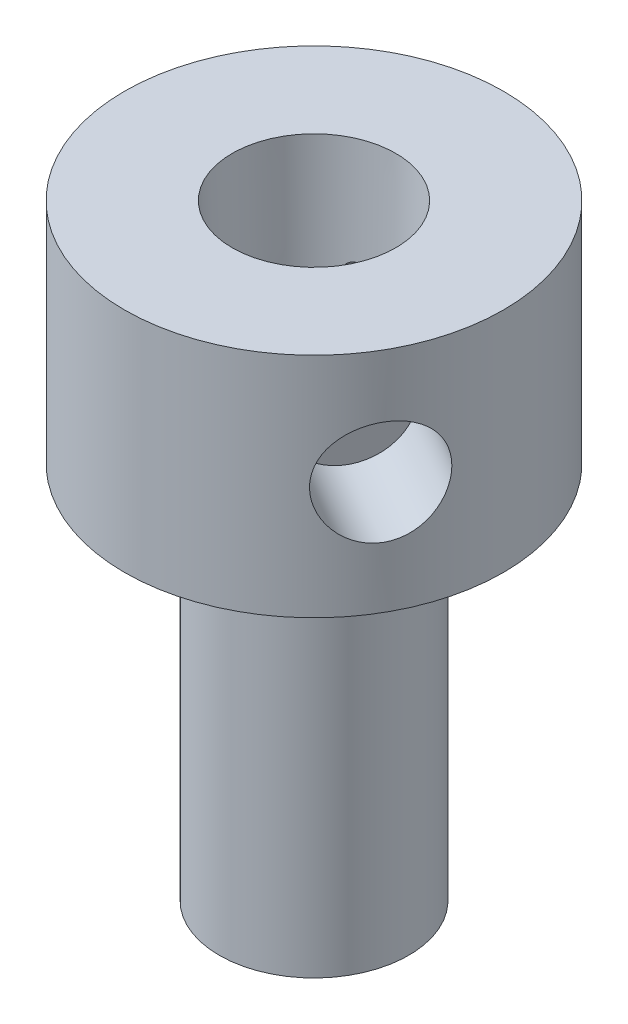
from build123d import *

# Parameters (mm, degrees)
SKETCH1_R                    = 15.875
BOSS_EXTRUDE1_DEPTH          = 50.8
SKETCH2_OUTSIDE_W            = 47.31
SKETCH2_OUTSIDE_H            = 47.31
SKETCH2_OUTSIDE_R            = 7.9375
CUT_EXTRUDE1_DEPTH           = 31.75
F_1_8_0_125_DIAMETER_HOLE1_D = 3.175
CUT_EXTRUDE5_START           = -31.75
SKETCH13_OUTSIDE_W           = 47.31
SKETCH13_OUTSIDE_H           = 47.31
SKETCH13_OUTSIDE_R           = 6.35
CUT_EXTRUDE5_DEPTH           = 1.5875
CUT_EXTRUDE6_REACH           = 65.16
CUT_EXTRUDE6_END_RADIUS      = 15.875
CUT_EXTRUDE6_START           = -7.62
SKETCH15_R                   = 4.365625
CUT_EXTRUDE7_REACH           = 60.178
SKETCH16_R                   = 0.79375
CIRPATTERN1_COUNT            = 2
CIRPATTERN1_ANGLE            = 120
CIRPATTERN2_COUNT            = 2
CIRPATTERN2_ANGLE            = 270


with BuildPart() as part:
    # Sketch1 → Boss-Extrude1 (new body)
    with BuildSketch(Plane(origin=(0, 0, 0), x_dir=(1, 0, 0), z_dir=(0, 1, 0))):
        with Locations(Location((0, 0, 0), (0, 0, 270))):
            Circle(SKETCH1_R)
    extrude(amount=BOSS_EXTRUDE1_DEPTH)

    # Sketch2 outside → Cut-Extrude1 (cut)
    with BuildSketch(Plane(origin=(0, 0, 0), x_dir=(-1, 0, 0), z_dir=(0, -1, 0))):
        Rectangle(SKETCH2_OUTSIDE_W, SKETCH2_OUTSIDE_H)
        with Locations(Location((0, 0, 0), (0, 0, 90))):
            Circle(SKETCH2_OUTSIDE_R, mode=Mode.SUBTRACT)
    extrude(amount=-CUT_EXTRUDE1_DEPTH, mode=Mode.SUBTRACT)

    # 1/8 (0.125) Diameter Hole1 (through all)
    with Locations(Plane(origin=(0, 50.8, 0), x_dir=(1, 0, 0), z_dir=(0, 1, 0))):
        with Locations((0, 0)):
            Hole(F_1_8_0_125_DIAMETER_HOLE1_D / 2)

    # Sketch6 → 1/4 NPT Tapped Hole1 (revolve, cut)
    with BuildSketch(Plane(origin=(0, 50.8, 0), x_dir=(0, 0, 1), z_dir=(1, 0, 0))):
        Polygon((0, 0), (0, 20.275689079), (5.5626, 16.9333418), (5.5626, 9.906), (6.557984794, 9.906), (6.8545837, 0), align=None)
    revolve(axis=Axis((0, 57.15, 0), (0, -1, 0)), mode=Mode.SUBTRACT)

    # Sketch13 outside → Cut-Extrude5 (cut)
    with BuildSketch(Plane.XZ.offset(CUT_EXTRUDE5_START)):
        Rectangle(SKETCH13_OUTSIDE_W, SKETCH13_OUTSIDE_H)
        with Locations(Location((0, 0, 0), (0, 0, 270))):
            Circle(SKETCH13_OUTSIDE_R, mode=Mode.SUBTRACT)
    extrude(amount=CUT_EXTRUDE5_DEPTH, mode=Mode.SUBTRACT)

    # Cut-Extrude6: up to this cylinder (the profile starts inside it)
    cut_extrude6_end = Plane(origin=(0, 41.207118, 0), z_dir=(0, -1, 0)) * Cylinder(CUT_EXTRUDE6_END_RADIUS, 163.07, mode=Mode.PRIVATE)
    # Sketch15 → Cut-Extrude6 (cut, up to the surface)
    with BuildSketch(Plane.XY.offset(CUT_EXTRUDE6_START), mode=Mode.PRIVATE) as cut_extrude6_sk1:
        with Locations((0, 41.207117901)):
            Circle(SKETCH15_R)
    cut_extrude6_tool1 = extrude(cut_extrude6_sk1.sketch, amount=-CUT_EXTRUDE6_REACH, mode=Mode.PRIVATE) & cut_extrude6_end
    cut_extrude6 = cut_extrude6_tool1.solids().sort_by_distance((0, 41.207118, -7.62))[0]
    add(cut_extrude6, mode=Mode.SUBTRACT)

    # Sketch16 → Cut-Extrude7 (cut, up to next)
    with BuildSketch(Plane(origin=(0, 0, -7.62), x_dir=(-1, 0, 0), z_dir=(0, 0, -1)), mode=Mode.PRIVATE) as cut_extrude7_sk1:
        with Locations((2.54, 41.207117901)):
            Circle(SKETCH16_R)
    cut_extrude7_tool1 = extrude(cut_extrude7_sk1.sketch, amount=-CUT_EXTRUDE7_REACH, mode=Mode.PRIVATE) & part.part
    cut_extrude7 = cut_extrude7_tool1.solids().sort_by_distance((-2.54, 41.207118, -7.62))[0]
    add(cut_extrude7, mode=Mode.SUBTRACT)

    # CirPattern1: Cut-Extrude6, Cut-Extrude7 ×2 about axis
    cirpattern1_axis = Axis((0, 50.8, 0), (0, -1, 0))
    add([cut_extrude6.rotate(cirpattern1_axis, i * CIRPATTERN1_ANGLE / (CIRPATTERN1_COUNT - 1)) for i in range(1, CIRPATTERN1_COUNT)], mode=Mode.SUBTRACT)
    add([cut_extrude7.rotate(cirpattern1_axis, i * CIRPATTERN1_ANGLE / (CIRPATTERN1_COUNT - 1)) for i in range(1, CIRPATTERN1_COUNT)], mode=Mode.SUBTRACT)

    # CirPattern2: Cut-Extrude6, Cut-Extrude7 ×2 about axis
    cirpattern2_axis = Axis((0, 50.8, 0), (0, -1, 0))
    add([cut_extrude6.rotate(cirpattern2_axis, i * CIRPATTERN2_ANGLE / (CIRPATTERN2_COUNT - 1)) for i in range(1, CIRPATTERN2_COUNT)], mode=Mode.SUBTRACT)
    add([cut_extrude7.rotate(cirpattern2_axis, i * CIRPATTERN2_ANGLE / (CIRPATTERN2_COUNT - 1)) for i in range(1, CIRPATTERN2_COUNT)], mode=Mode.SUBTRACT)


solid = part.part
